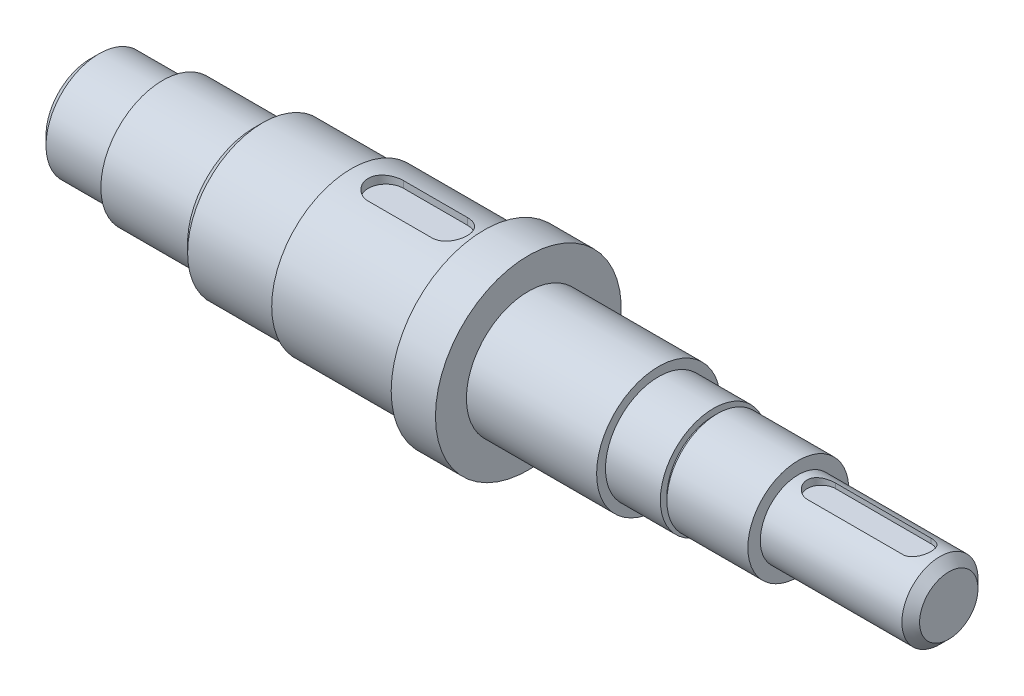
from build123d import *

# Parameters (mm, degrees)
CHAMFER1_SIZE      = 5
CUT_EXTRUDE1_START = 45
CUT_EXTRUDE1_DEPTH = 4.9
CUT_EXTRUDE2_START = 21.5
CUT_EXTRUDE2_DEPTH = 4.3


with BuildPart() as part:
    # Sketch2 → Revolve1 (revolve)
    with BuildSketch(Plane(origin=(0, 0, 0), x_dir=(1, 0, 0), z_dir=(0, 1, 0)), mode=Mode.PRIVATE) as revolve1_sk:
        Polygon((242.5, 0), (-242.5, 0), (-242.5, 30), (-201.5, 30), (-201.5, 35), (-150, 35), (-150, 42.5), (-95, 42.5), (-95, 45), (-20, 45), (-20, 52.5), (5, 52.5), (5, 35), (78.55, 35), (78.55, 30), (109.55, 30), (109.55, 26.3), (111.75, 26.3), (111.75, 28.5), (157.5, 28.5), (157.5, 21.5), (242.5, 21.5), align=None)
    revolve(revolve1_sk.sketch.rotate(Axis((-418.822463349, 0, 0), (1, 0, 0)), 180), axis=Axis((-418.822463349, 0, 0), (1, 0, 0)))

    # Chamfer1
    chamfer1_edges = [part.edges().sort_by_distance(p)[0] for p in [
        (242.5, 0, -21.5),
        (-150, 0, -42.5),
        (-242.5, 0, -30),
    ]]
    chamfer(chamfer1_edges, length=CHAMFER1_SIZE)

    # Sketch3 → Cut-Extrude1 (cut, symmetric)
    with BuildSketch(Plane(origin=(0, 0, 0), x_dir=(1, 0, 0), z_dir=(0, 1, 0)).offset(CUT_EXTRUDE1_START)):
        with BuildLine():
            Line((-75.5, 10), (-39.5, 10))
            ThreePointArc((-39.5, 10), (-29.5, 0), (-39.5, -10))
            Line((-39.5, -10), (-75.5, -10))
            ThreePointArc((-75.5, -10), (-85.5, 0), (-75.5, 10))
        make_face()
    extrude(amount=CUT_EXTRUDE1_DEPTH, both=True, mode=Mode.SUBTRACT)

    # Sketch4 → Cut-Extrude2 (cut, symmetric)
    with BuildSketch(Plane(origin=(0, 0, 0), x_dir=(1, 0, 0), z_dir=(0, 1, 0)).offset(CUT_EXTRUDE2_START)):
        with BuildLine():
            Line((170.5, 8), (224.5, 8))
            ThreePointArc((224.5, 8), (232.5, 0), (224.5, -8))
            Line((224.5, -8), (170.5, -8))
            ThreePointArc((170.5, -8), (162.5, 0), (170.5, 8))
        make_face()
    extrude(amount=CUT_EXTRUDE2_DEPTH, both=True, mode=Mode.SUBTRACT)


solid = part.part
